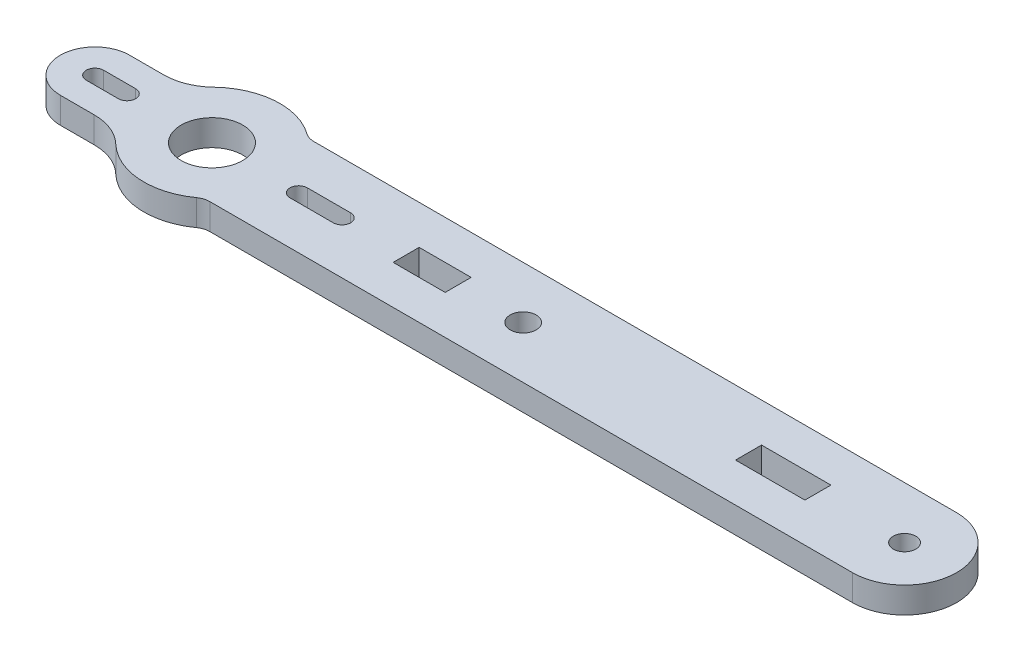
from build123d import *

# Parameters (mm, degrees)
ESBO_O1_R                    = 4
ESBO_O1_R_2                  = 7.85
ESBO_O1_R_3                  = 6
RESSALTO_EXTRUS_O1_DEPTH     = 3
FURO_DE_DI_METRO_7_1_7_1_1_D = 7.1
CORTE_EXTRUS_O1_DEPTH        = 100.754611422
ESBO_O3_W                    = 8
ESBO_O3_H                    = 3
ESBO_O3_W_2                  = 6
CORTE_EXTRUS_O2_DEPTH        = 100.754611422
FURO_DE_DI_METRO_2_6_2_6_1_D = 2.6
FURO_DE_DI_METRO_3_0_3_1_D   = 3
FILETE1_R                    = 2
FILETE2_R                    = 6


with BuildPart() as part:
    # Esboço1 → Ressalto-extrusão1 (new body)
    with BuildSketch(Plane(origin=(0, 0, 0), x_dir=(1, 0, 0), z_dir=(0, 1, 0))):
        Circle(ESBO_O1_R)
        with BuildLine():
            ThreePointArc((6.745557018, -4), (5.65, 0), (6.745557018, 4))
            Line((6.745557018, 4), (0, 4))
            ThreePointArc((0, 4), (2.828427125, 2.828427125), (4, 0))
            ThreePointArc((4, 0), (2.828427125, -2.828427125), (0, -4))
            Line((0, -4), (6.745557018, -4))
        make_face()
        with Locations((13.5, 0)):
            Circle(ESBO_O1_R_2)
        with BuildLine():
            ThreePointArc((93.4, -6), (87.4, 0), (93.4, 6))
            Line((93.4, 6), (18.561867244, 6))
            ThreePointArc((18.561867244, 6), (20.618924001, 3.308084199), (21.35, 0))
            ThreePointArc((21.35, 0), (20.618924001, -3.308084199), (18.561867244, -6))
            Line((18.561867244, -6), (93.4, -6))
        make_face()
        with Locations((93.4, 0)):
            Circle(ESBO_O1_R_3)
    extrude(amount=-RESSALTO_EXTRUS_O1_DEPTH)

    # Furo de diâmetro Ø7.1 (7.1)1 (through all)
    with Locations(Plane(origin=(0, 0, 0), x_dir=(1, 0, 0), z_dir=(0, 1, 0))):
        with Locations((13.5, 0)):
            Hole(FURO_DE_DI_METRO_7_1_7_1_1_D / 2)

    # Esboço2 → Corte-extrusão1 (cut, through all)
    with BuildSketch(Plane(origin=(0, 0, 0), x_dir=(1, 0, 0), z_dir=(0, 1, 0))):
        with BuildLine():
            Line((0, 1), (3.7, 1))
            ThreePointArc((3.7, 1), (4.7, 0), (3.7, -1))
            Line((3.7, -1), (0, -1))
            ThreePointArc((0, -1), (-1, 0), (0, 1))
        make_face()
        with BuildLine():
            Line((23.5, 1), (28.5, 1))
            ThreePointArc((28.5, 1), (29.5, 0), (28.5, -1))
            Line((28.5, -1), (23.5, -1))
            ThreePointArc((23.5, -1), (22.5, 0), (23.5, 1))
        make_face()
    extrude(amount=-CORTE_EXTRUS_O1_DEPTH, mode=Mode.SUBTRACT)

    # Esboço3 → Corte-extrusão2 (cut, through all)
    with BuildSketch(Plane(origin=(0, 0, 0), x_dir=(1, 0, 0), z_dir=(0, 1, 0))):
        with Locations((79.4, 0)):
            Rectangle(ESBO_O3_W, ESBO_O3_H)
        with Locations((38.9, 0)):
            Rectangle(ESBO_O3_W_2, ESBO_O3_H)
    extrude(amount=-CORTE_EXTRUS_O2_DEPTH, mode=Mode.SUBTRACT)

    # Furo de diâmetro Ø2.6 (2.6)1 (through all)
    with Locations(Plane(origin=(0, 0, 0), x_dir=(1, 0, 0), z_dir=(0, 1, 0))):
        with Locations((93.4, 0)):
            Hole(FURO_DE_DI_METRO_2_6_2_6_1_D / 2)

    # Furo de diâmetro Ø3.0 (3)1 (through all)
    with Locations(Plane(origin=(0, 0, 0), x_dir=(1, 0, 0), z_dir=(0, 1, 0))):
        with Locations((49.4, 0)):
            Hole(FURO_DE_DI_METRO_3_0_3_1_D / 2)

    # Filete1
    filete1_edges = [part.edges().sort_by_distance(p)[0] for p in [
        (18.561867244, -1.5, -6),
        (18.561867244, -1.5, 6),
    ]]
    fillet(filete1_edges, radius=FILETE1_R)

    # Filete2
    filete2_edges = [part.edges().sort_by_distance(p)[0] for p in [
        (6.745557018, -1.5, -4),
        (6.745557018, -1.5, 4),
    ]]
    fillet(filete2_edges, radius=FILETE2_R)


solid = part.part
